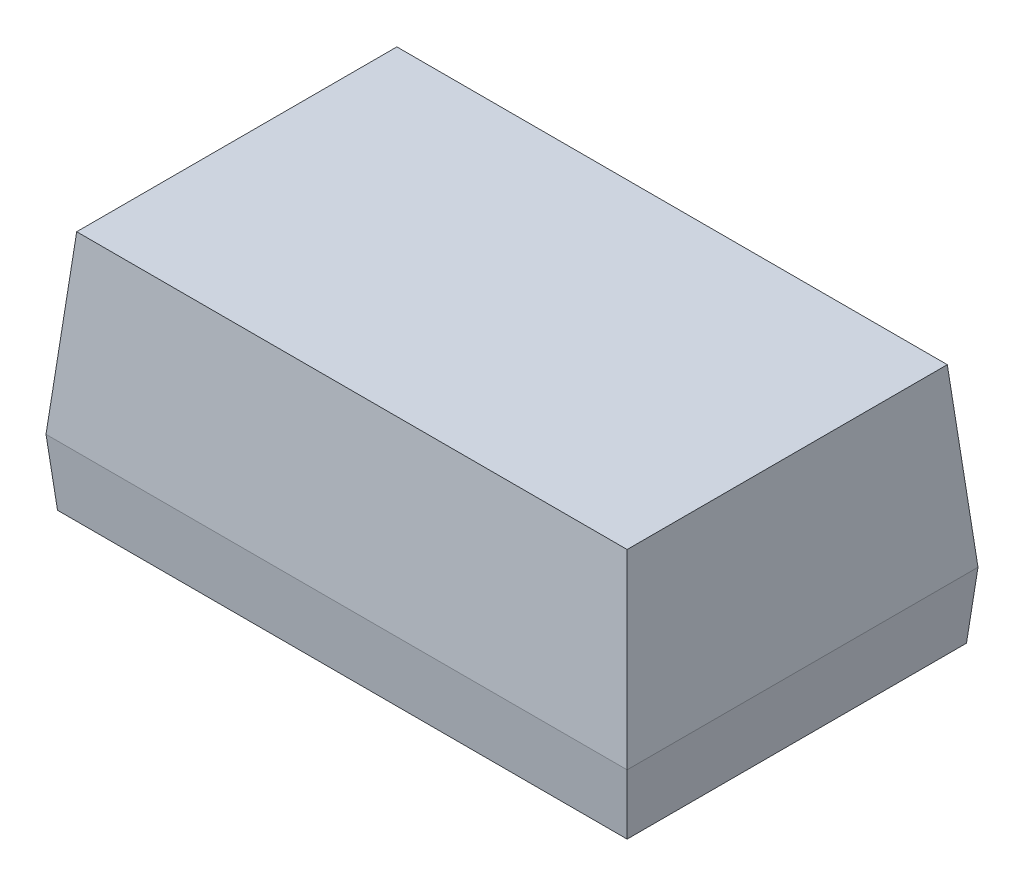
from build123d import *

# Parameters (mm, degrees)
SKETCH1_W                     = 2.65
SKETCH1_H                     = 1.6
BOSS_EXTRUDE1_DEPTH           = 0.8
BOSS_EXTRUDE1_TAPER           = 5
BOSS_EXTRUDE1_OTHER_WAY_DEPTH = 0.3
BOSS_EXTRUDE1_OTHER_WAY_TAPER = 5


with BuildPart() as part:
    # Sketch1 → Boss-Extrude1 (new body)
    with BuildSketch(Plane(origin=(0, 0, 0), x_dir=(1, 0, 0), z_dir=(0, 1, 0))):
        Rectangle(SKETCH1_W, SKETCH1_H)
    extrude(amount=BOSS_EXTRUDE1_DEPTH, taper=BOSS_EXTRUDE1_TAPER)

    # Sketch1 → Boss-Extrude1 other way (add)
    with BuildSketch(Plane(origin=(0, 0, 0), x_dir=(1, 0, 0), z_dir=(0, 1, 0))):
        Rectangle(SKETCH1_W, SKETCH1_H)
    extrude(amount=-BOSS_EXTRUDE1_OTHER_WAY_DEPTH, taper=BOSS_EXTRUDE1_OTHER_WAY_TAPER)


solid = part.part
